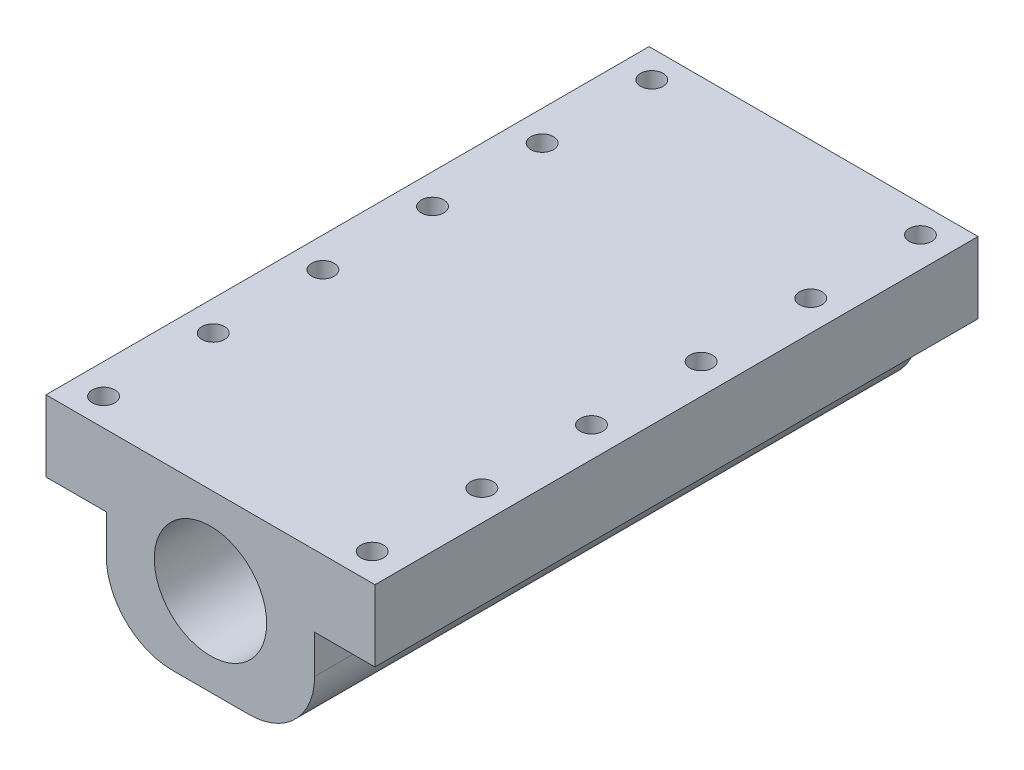
from build123d import *

# Parameters (mm, degrees)
CROQUIS1_R              = 10.25
SALIENTE_EXTRUIR1_DEPTH = 110
CORTAR_EXTRUIR1_REACH   = 117.59
CROQUIS2_R              = 2.06


with BuildPart() as part:
    # Croquis1 → Saliente-Extruir1 (new body)
    with BuildSketch(Plane.XY):
        with BuildLine():
            Line((30, 16), (-30, 16))
            Line((-30, 16), (-30, 3))
            Line((-30, 3), (-19, 3))
            Line((-19, 3), (-19, -4))
            ThreePointArc((-19, -4), (-15.485281374, -12.485281374), (-7, -16))
            Line((-7, -16), (7, -16))
            ThreePointArc((7, -16), (15.485281374, -12.485281374), (19, -4))
            Line((19, -4), (19, 3))
            Line((19, 3), (30, 3))
            Line((30, 3), (30, 16))
        make_face()
        Circle(CROQUIS1_R, mode=Mode.SUBTRACT)
    extrude(amount=SALIENTE_EXTRUIR1_DEPTH)

    # Croquis2 → Cortar-Extruir1 (cut, up to next)
    with BuildSketch(Plane.XZ.offset(-3), mode=Mode.PRIVATE) as cortar_extruir1_sk1:
        with Locations(Location((-24.5, 105, 0), (0, 0, 270))):
            Circle(CROQUIS2_R)
    cortar_extruir1_tool1 = extrude(cortar_extruir1_sk1.sketch, amount=-CORTAR_EXTRUIR1_REACH, mode=Mode.PRIVATE) & part.part
    # Croquis2 → Cortar-Extruir1 (cut, up to next)
    with BuildSketch(Plane.XZ.offset(-3), mode=Mode.PRIVATE) as cortar_extruir1_sk2:
        with Locations(Location((-24.5, 85, 0), (0, 0, 270))):
            Circle(CROQUIS2_R)
    cortar_extruir1_tool2 = extrude(cortar_extruir1_sk2.sketch, amount=-CORTAR_EXTRUIR1_REACH, mode=Mode.PRIVATE) & part.part
    # Croquis2 → Cortar-Extruir1 (cut, up to next)
    with BuildSketch(Plane.XZ.offset(-3), mode=Mode.PRIVATE) as cortar_extruir1_sk3:
        with Locations(Location((-24.5, 65, 0), (0, 0, 270))):
            Circle(CROQUIS2_R)
    cortar_extruir1_tool3 = extrude(cortar_extruir1_sk3.sketch, amount=-CORTAR_EXTRUIR1_REACH, mode=Mode.PRIVATE) & part.part
    # Croquis2 → Cortar-Extruir1 (cut, up to next)
    with BuildSketch(Plane.XZ.offset(-3), mode=Mode.PRIVATE) as cortar_extruir1_sk4:
        with Locations(Location((-24.5, 45, 0), (0, 0, 270))):
            Circle(CROQUIS2_R)
    cortar_extruir1_tool4 = extrude(cortar_extruir1_sk4.sketch, amount=-CORTAR_EXTRUIR1_REACH, mode=Mode.PRIVATE) & part.part
    # Croquis2 → Cortar-Extruir1 (cut, up to next)
    with BuildSketch(Plane.XZ.offset(-3), mode=Mode.PRIVATE) as cortar_extruir1_sk5:
        with Locations(Location((-24.5, 25, 0), (0, 0, 270))):
            Circle(CROQUIS2_R)
    cortar_extruir1_tool5 = extrude(cortar_extruir1_sk5.sketch, amount=-CORTAR_EXTRUIR1_REACH, mode=Mode.PRIVATE) & part.part
    # Croquis2 → Cortar-Extruir1 (cut, up to next)
    with BuildSketch(Plane.XZ.offset(-3), mode=Mode.PRIVATE) as cortar_extruir1_sk6:
        with Locations(Location((-24.5, 5, 0), (0, 0, 270))):
            Circle(CROQUIS2_R)
    cortar_extruir1_tool6 = extrude(cortar_extruir1_sk6.sketch, amount=-CORTAR_EXTRUIR1_REACH, mode=Mode.PRIVATE) & part.part
    # Croquis2 → Cortar-Extruir1 (cut, up to next)
    with BuildSketch(Plane.XZ.offset(-3), mode=Mode.PRIVATE) as cortar_extruir1_sk7:
        with Locations(Location((24.5, 5, 0), (0, 0, 270))):
            Circle(CROQUIS2_R)
    cortar_extruir1_tool7 = extrude(cortar_extruir1_sk7.sketch, amount=-CORTAR_EXTRUIR1_REACH, mode=Mode.PRIVATE) & part.part
    # Croquis2 → Cortar-Extruir1 (cut, up to next)
    with BuildSketch(Plane.XZ.offset(-3), mode=Mode.PRIVATE) as cortar_extruir1_sk8:
        with Locations(Location((24.5, 25, 0), (0, 0, 270))):
            Circle(CROQUIS2_R)
    cortar_extruir1_tool8 = extrude(cortar_extruir1_sk8.sketch, amount=-CORTAR_EXTRUIR1_REACH, mode=Mode.PRIVATE) & part.part
    # Croquis2 → Cortar-Extruir1 (cut, up to next)
    with BuildSketch(Plane.XZ.offset(-3), mode=Mode.PRIVATE) as cortar_extruir1_sk9:
        with Locations(Location((24.5, 45, 0), (0, 0, 270))):
            Circle(CROQUIS2_R)
    cortar_extruir1_tool9 = extrude(cortar_extruir1_sk9.sketch, amount=-CORTAR_EXTRUIR1_REACH, mode=Mode.PRIVATE) & part.part
    # Croquis2 → Cortar-Extruir1 (cut, up to next)
    with BuildSketch(Plane.XZ.offset(-3), mode=Mode.PRIVATE) as cortar_extruir1_sk10:
        with Locations(Location((24.5, 65, 0), (0, 0, 270))):
            Circle(CROQUIS2_R)
    cortar_extruir1_tool10 = extrude(cortar_extruir1_sk10.sketch, amount=-CORTAR_EXTRUIR1_REACH, mode=Mode.PRIVATE) & part.part
    # Croquis2 → Cortar-Extruir1 (cut, up to next)
    with BuildSketch(Plane.XZ.offset(-3), mode=Mode.PRIVATE) as cortar_extruir1_sk11:
        with Locations(Location((24.5, 85, 0), (0, 0, 270))):
            Circle(CROQUIS2_R)
    cortar_extruir1_tool11 = extrude(cortar_extruir1_sk11.sketch, amount=-CORTAR_EXTRUIR1_REACH, mode=Mode.PRIVATE) & part.part
    # Croquis2 → Cortar-Extruir1 (cut, up to next)
    with BuildSketch(Plane.XZ.offset(-3), mode=Mode.PRIVATE) as cortar_extruir1_sk12:
        with Locations(Location((24.5, 105, 0), (0, 0, 270))):
            Circle(CROQUIS2_R)
    cortar_extruir1_tool12 = extrude(cortar_extruir1_sk12.sketch, amount=-CORTAR_EXTRUIR1_REACH, mode=Mode.PRIVATE) & part.part
    add(cortar_extruir1_tool1.solids().sort_by_distance((-24.5, 3, 105))[0], mode=Mode.SUBTRACT)
    add(cortar_extruir1_tool2.solids().sort_by_distance((-24.5, 3, 85))[0], mode=Mode.SUBTRACT)
    add(cortar_extruir1_tool3.solids().sort_by_distance((-24.5, 3, 65))[0], mode=Mode.SUBTRACT)
    add(cortar_extruir1_tool4.solids().sort_by_distance((-24.5, 3, 45))[0], mode=Mode.SUBTRACT)
    add(cortar_extruir1_tool5.solids().sort_by_distance((-24.5, 3, 25))[0], mode=Mode.SUBTRACT)
    add(cortar_extruir1_tool6.solids().sort_by_distance((-24.5, 3, 5))[0], mode=Mode.SUBTRACT)
    add(cortar_extruir1_tool7.solids().sort_by_distance((24.5, 3, 5))[0], mode=Mode.SUBTRACT)
    add(cortar_extruir1_tool8.solids().sort_by_distance((24.5, 3, 25))[0], mode=Mode.SUBTRACT)
    add(cortar_extruir1_tool9.solids().sort_by_distance((24.5, 3, 45))[0], mode=Mode.SUBTRACT)
    add(cortar_extruir1_tool10.solids().sort_by_distance((24.5, 3, 65))[0], mode=Mode.SUBTRACT)
    add(cortar_extruir1_tool11.solids().sort_by_distance((24.5, 3, 85))[0], mode=Mode.SUBTRACT)
    add(cortar_extruir1_tool12.solids().sort_by_distance((24.5, 3, 105))[0], mode=Mode.SUBTRACT)


solid = part.part
